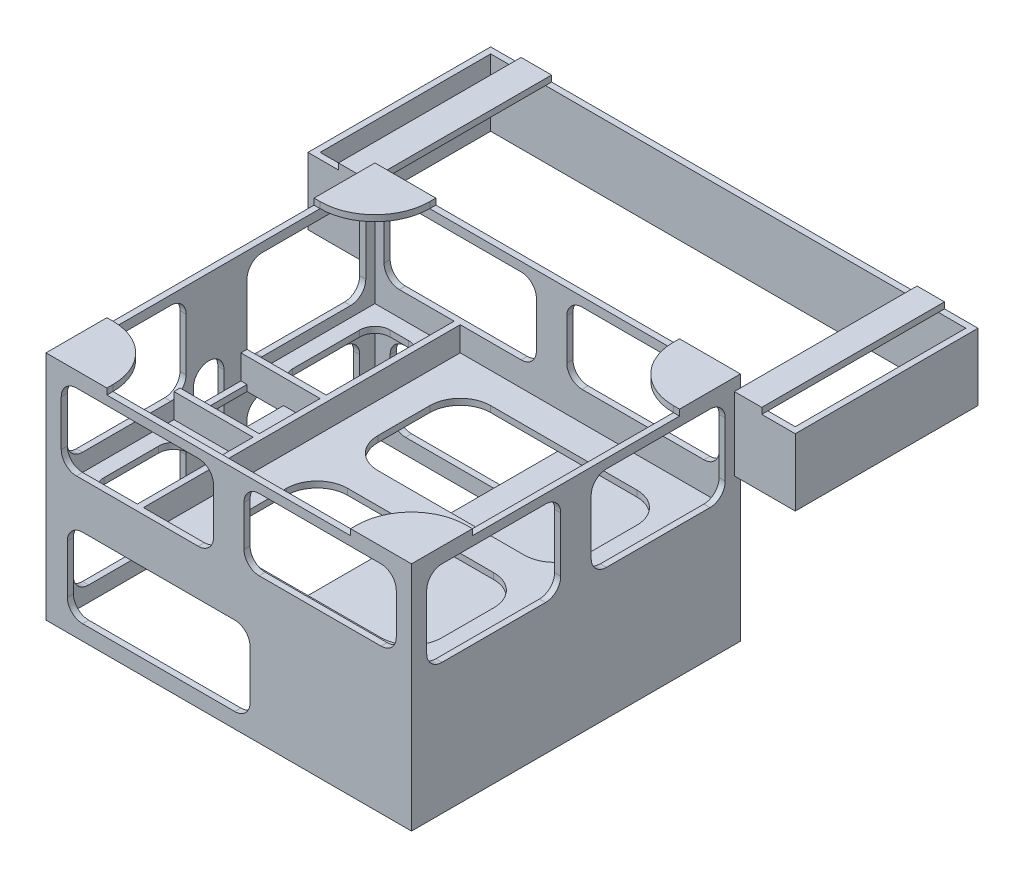
from build123d import *

# Parameters (mm, degrees)
SKETCH1_W                = 60
SKETCH1_H                = 54
BOSS_EXTRUDE1_DEPTH      = 38
SKETCH2_W                = 44
SKETCH2_H                = 52
CUT_EXTRUDE1_DEPTH       = 19
SKETCH3_W                = 35
SKETCH3_H                = 52
CUT_EXTRUDE2_DEPTH       = 18
SKETCH4_W                = 6
SKETCH4_H                = 10
CUT_EXTRUDE3_DEPTH       = 38
SKETCH5_W                = 14
SKETCH5_H                = 52
CUT_EXTRUDE5_DEPTH       = 15
SKETCH6_W                = 13
SKETCH6_H                = 52
CUT_EXTRUDE6_DEPTH       = 4
SKETCH8_W                = 15
SKETCH8_H                = 13
CUT_EXTRUDE7_DEPTH       = 6
SKETCH10_W               = 13
SKETCH10_H               = 5
CUT_EXTRUDE8_DEPTH       = 6
SKETCH11_W               = 4
SKETCH11_H               = 5
CUT_EXTRUDE9_DEPTH       = 3
SKETCH12_W               = 5
SKETCH12_H               = 2
CUT_EXTRUDE10_DEPTH      = 13
CUT_EXTRUDE11_DEPTH      = 1
SKETCH14_W               = 13
SKETCH14_H               = 1
BOSS_EXTRUDE2_DEPTH      = 4
SKETCH15_W               = 13
SKETCH15_H               = 1
BOSS_EXTRUDE3_DEPTH      = 4
CUT_EXTRUDE12_DEPTH      = 1
CUT_EXTRUDE13_DEPTH      = 1
CUT_EXTRUDE14_DEPTH      = 1
CUT_EXTRUDE15_DEPTH      = 60
CUT_EXTRUDE16_START      = -1
CUT_EXTRUDE16_DEPTH      = 1
CUT_EXTRUDE17_DEPTH      = 100
CUT_EXTRUDE17_DEPTH_BACK = 10
CUT_EXTRUDE18_DEPTH      = 10
SKETCH23_W               = 58
SKETCH23_H               = 52
BOSS_EXTRUDE4_DEPTH      = 1
SKETCH24_W               = 40
SKETCH24_H               = 10
SKETCH24_W_2             = 10
SKETCH24_H_2             = 34
CUT_EXTRUDE20_DEPTH      = 1
FILLET1_R                = 9
FILLET2_R                = 9
FILLET3_R                = 9
FILLET4_R                = 9
SKETCH27_W               = 10
SKETCH27_H               = 11
BOSS_EXTRUDE10_DEPTH     = 1
SKETCH31_W               = 1
SKETCH31_H               = 11
BOSS_EXTRUDE12_DEPTH     = 29
SKETCH33_W               = 1
SKETCH33_H               = 11
BOSS_EXTRUDE13_DEPTH     = 78
SKETCH34_W               = 5
SKETCH34_H               = 30
SKETCH34_W_2             = 4.5
BOSS_EXTRUDE14_DEPTH     = 1


with BuildPart() as part:
    # Sketch1 → Boss-Extrude1 (new body)
    with BuildSketch(Plane(origin=(0, 0, 0), x_dir=(1, 0, 0), z_dir=(0, 1, 0))):
        with Locations((-83.874465942, -33.946435202)):
            Rectangle(SKETCH1_W, SKETCH1_H)
    extrude(amount=BOSS_EXTRUDE1_DEPTH)

    # Sketch2 → Cut-Extrude1 (cut)
    with BuildSketch(Plane(origin=(0, 38, 0), x_dir=(1, 0, 0), z_dir=(0, 1, 0))):
        with Locations((-76.874465942, -33.946435202)):
            Rectangle(SKETCH2_W, SKETCH2_H)
    extrude(amount=-CUT_EXTRUDE1_DEPTH, mode=Mode.SUBTRACT)

    # Sketch3 → Cut-Extrude2 (cut)
    with BuildSketch(Plane(origin=(0, 0, 0), x_dir=(-1, 0, 0), z_dir=(0, -1, 0))):
        with Locations((95.374465942, -33.946435202)):
            Rectangle(SKETCH3_W, SKETCH3_H)
    extrude(amount=-CUT_EXTRUDE2_DEPTH, mode=Mode.SUBTRACT)

    # Sketch4 → Cut-Extrude3 (cut)
    with BuildSketch(Plane(origin=(0, 18, 0), x_dir=(-1, 0, 0), z_dir=(0, -1, 0))):
        with Locations((108.874465942, -34.946435202)):
            Rectangle(SKETCH4_W, SKETCH4_H)
    extrude(amount=-CUT_EXTRUDE3_DEPTH, mode=Mode.SUBTRACT)

    # Sketch5 → Cut-Extrude5 (cut)
    with BuildSketch(Plane(origin=(0, 38, 0), x_dir=(1, 0, 0), z_dir=(0, 1, 0))):
        with Locations((-105.874465942, -33.946435202)):
            Rectangle(SKETCH5_W, SKETCH5_H)
    extrude(amount=-CUT_EXTRUDE5_DEPTH, mode=Mode.SUBTRACT)

    # Sketch6 → Cut-Extrude6 (cut)
    with BuildSketch(Plane(origin=(0, 23, 0), x_dir=(1, 0, 0), z_dir=(0, 1, 0))):
        with Locations((-106.374465942, -33.946435202)):
            Rectangle(SKETCH6_W, SKETCH6_H)
    extrude(amount=-CUT_EXTRUDE6_DEPTH, mode=Mode.SUBTRACT)

    # Sketch8 → Cut-Extrude7 (cut)
    with BuildSketch(Plane(origin=(0, 0, 0), x_dir=(-1, 0, 0), z_dir=(0, -1, 0))):
        with Locations((65.874465942, -17.946435202)):
            Rectangle(SKETCH8_W, SKETCH8_H)
    extrude(amount=-CUT_EXTRUDE7_DEPTH, mode=Mode.SUBTRACT)

    # Sketch10 → Cut-Extrude8 (cut)
    with BuildSketch(Plane(origin=(-73.374465942, 0, 0), x_dir=(0, 0, -1), z_dir=(1, 0, 0))):
        with Locations((-17.946435202, 3.5)):
            Rectangle(SKETCH10_W, SKETCH10_H)
    extrude(amount=-CUT_EXTRUDE8_DEPTH, mode=Mode.SUBTRACT)

    # Sketch11 → Cut-Extrude9 (cut)
    with BuildSketch(Plane.XZ):
        with Locations((-65.874465942, 48.446435202)):
            Rectangle(SKETCH11_W, SKETCH11_H)
    extrude(amount=-CUT_EXTRUDE9_DEPTH, mode=Mode.SUBTRACT)

    # Sketch12 → Cut-Extrude10 (cut)
    with BuildSketch(Plane(origin=(-67.874465942, 0, 0), x_dir=(0, 0, -1), z_dir=(1, 0, 0))):
        with Locations((-48.446435202, 2)):
            Rectangle(SKETCH12_W, SKETCH12_H)
    extrude(amount=-CUT_EXTRUDE10_DEPTH, mode=Mode.SUBTRACT)

    # Sketch13 → Cut-Extrude11 (cut)
    with BuildSketch(Plane.ZY.offset(113.874465942)):
        with BuildLine():
            Line((32.733045904, 15), (32.733045904, 22))
            ThreePointArc((32.733045904, 22), (35.233045904, 24.5), (37.733045904, 22))
            Line((37.733045904, 22), (37.733045904, 15))
            ThreePointArc((37.733045904, 15), (35.233045904, 12.5), (32.733045904, 15))
        make_face()
    extrude(amount=-CUT_EXTRUDE11_DEPTH, mode=Mode.SUBTRACT)

    # Sketch14 → Boss-Extrude2 (add)
    with BuildSketch(Plane(origin=(0, 19, 0), x_dir=(1, 0, 0), z_dir=(0, 1, 0))):
        with Locations((-106.374465942, -40.446435202)):
            Rectangle(SKETCH14_W, SKETCH14_H)
    extrude(amount=BOSS_EXTRUDE2_DEPTH)

    # Sketch15 → Boss-Extrude3 (add)
    with BuildSketch(Plane(origin=(0, 19, 0), x_dir=(1, 0, 0), z_dir=(0, 1, 0))):
        with Locations((-106.374465942, -29.446435202)):
            Rectangle(SKETCH15_W, SKETCH15_H)
    extrude(amount=BOSS_EXTRUDE3_DEPTH)

    # Sketch16 → Cut-Extrude12 (cut)
    with BuildSketch(Plane(origin=(0, 19, 0), x_dir=(1, 0, 0), z_dir=(0, 1, 0))):
        with BuildLine():
            Line((-64.874465942, -54.946435202), (-88.874465942, -54.946435202))
            ThreePointArc((-88.874465942, -54.946435202), (-92.409999848, -53.481969108), (-93.874465942, -49.946435202))
            Line((-93.874465942, -49.946435202), (-93.874465942, -41.446435202))
            ThreePointArc((-93.874465942, -41.446435202), (-92.409999848, -37.910901296), (-88.874465942, -36.446435202))
            Line((-88.874465942, -36.446435202), (-64.874465942, -36.446435202))
            ThreePointArc((-64.874465942, -36.446435202), (-61.338932037, -37.910901296), (-59.874465942, -41.446435202))
            Line((-59.874465942, -41.446435202), (-59.874465942, -49.946435202))
            ThreePointArc((-59.874465942, -49.946435202), (-61.338932037, -53.481969108), (-64.874465942, -54.946435202))
        make_face()
        with BuildLine():
            Line((-88.874465942, -31.446435202), (-64.874465942, -31.446435202))
            ThreePointArc((-64.874465942, -31.446435202), (-61.338932037, -29.981969108), (-59.874465942, -26.446435202))
            Line((-59.874465942, -26.446435202), (-59.874465942, -17.946435202))
            ThreePointArc((-59.874465942, -17.946435202), (-61.338932037, -14.410901296), (-64.874465942, -12.946435202))
            Line((-64.874465942, -12.946435202), (-88.874465942, -12.946435202))
            ThreePointArc((-88.874465942, -12.946435202), (-92.409999848, -14.410901296), (-93.874465942, -17.946435202))
            Line((-93.874465942, -17.946435202), (-93.874465942, -26.446435202))
            ThreePointArc((-93.874465942, -26.446435202), (-92.409999848, -29.981969108), (-88.874465942, -31.446435202))
        make_face()
    extrude(amount=-CUT_EXTRUDE12_DEPTH, mode=Mode.SUBTRACT)

    # Sketch17 → Cut-Extrude13 (cut)
    with BuildSketch(Plane(origin=(0, 19, 0), x_dir=(1, 0, 0), z_dir=(0, 1, 0))):
        with BuildLine():
            Line((-104.874465942, -57.446435202), (-107.874465942, -57.446435202))
            ThreePointArc((-107.874465942, -57.446435202), (-109.642232895, -56.714202155), (-110.374465942, -54.946435202))
            Line((-110.374465942, -54.946435202), (-110.374465942, -45.946435202))
            ThreePointArc((-110.374465942, -45.946435202), (-109.642232895, -44.178668249), (-107.874465942, -43.446435202))
            Line((-107.874465942, -43.446435202), (-104.874465942, -43.446435202))
            ThreePointArc((-104.874465942, -43.446435202), (-103.10669899, -44.178668249), (-102.374465942, -45.946435202))
            Line((-102.374465942, -45.946435202), (-102.374465942, -54.946435202))
            ThreePointArc((-102.374465942, -54.946435202), (-103.10669899, -56.714202155), (-104.874465942, -57.446435202))
        make_face()
        with BuildLine():
            Line((-104.874465942, -26.446435202), (-107.874465942, -26.446435202))
            ThreePointArc((-107.874465942, -26.446435202), (-109.642232895, -25.714202155), (-110.374465942, -23.946435202))
            Line((-110.374465942, -23.946435202), (-110.374465942, -12.946435202))
            ThreePointArc((-110.374465942, -12.946435202), (-109.642232895, -11.178668249), (-107.874465942, -10.446435202))
            Line((-107.874465942, -10.446435202), (-104.874465942, -10.446435202))
            ThreePointArc((-104.874465942, -10.446435202), (-103.10669899, -11.178668249), (-102.374465942, -12.946435202))
            Line((-102.374465942, -12.946435202), (-102.374465942, -23.946435202))
            ThreePointArc((-102.374465942, -23.946435202), (-103.10669899, -25.714202155), (-104.874465942, -26.446435202))
        make_face()
    extrude(amount=-CUT_EXTRUDE13_DEPTH, mode=Mode.SUBTRACT)

    # Sketch18 → Cut-Extrude14 (cut)
    with BuildSketch(Plane(origin=(-53.874465942, 0, 0), x_dir=(0, 0, -1), z_dir=(1, 0, 0))):
        with BuildLine():
            Line((-55.946435202, 35.5), (-38.946435202, 35.5))
            ThreePointArc((-38.946435202, 35.5), (-37.178668249, 34.767766953), (-36.446435202, 33))
            Line((-36.446435202, 33), (-36.446435202, 24))
            ThreePointArc((-36.446435202, 24), (-37.178668249, 22.232233047), (-38.946435202, 21.5))
            Line((-38.946435202, 21.5), (-55.946435202, 21.5))
            ThreePointArc((-55.946435202, 21.5), (-57.714202155, 22.232233047), (-58.446435202, 24))
            Line((-58.446435202, 24), (-58.446435202, 33))
            ThreePointArc((-58.446435202, 33), (-57.714202155, 34.767766953), (-55.946435202, 35.5))
        make_face()
        with BuildLine():
            Line((-28.946435202, 35.5), (-11.946435202, 35.5))
            ThreePointArc((-11.946435202, 35.5), (-10.178668249, 34.767766953), (-9.446435202, 33))
            Line((-9.446435202, 33), (-9.446435202, 24))
            ThreePointArc((-9.446435202, 24), (-10.178668249, 22.232233047), (-11.946435202, 21.5))
            Line((-11.946435202, 21.5), (-28.946435202, 21.5))
            ThreePointArc((-28.946435202, 21.5), (-30.714202155, 22.232233047), (-31.446435202, 24))
            Line((-31.446435202, 24), (-31.446435202, 33))
            ThreePointArc((-31.446435202, 33), (-30.714202155, 34.767766953), (-28.946435202, 35.5))
        make_face()
    extrude(amount=-CUT_EXTRUDE14_DEPTH, mode=Mode.SUBTRACT)

    # Sketch19 → Cut-Extrude15 (cut)
    with BuildSketch(Plane(origin=(0, 0, 6.946435202), x_dir=(-1, 0, 0), z_dir=(0, 0, -1))):
        with BuildLine():
            Line((58.874465942, 35.5), (78.874465942, 35.5))
            ThreePointArc((78.874465942, 35.5), (80.642232895, 34.767766953), (81.374465942, 33))
            Line((81.374465942, 33), (81.374465942, 26.304053451))
            ThreePointArc((81.374465942, 26.304053451), (80.642232895, 24.536286498), (78.874465942, 23.804053451))
            Line((78.874465942, 23.804053451), (58.874465942, 23.804053451))
            ThreePointArc((58.874465942, 23.804053451), (57.10669899, 24.536286498), (56.374465942, 26.304053451))
            Line((56.374465942, 26.304053451), (56.374465942, 33))
            ThreePointArc((56.374465942, 33), (57.10669899, 34.767766953), (58.874465942, 35.5))
        make_face()
        with BuildLine():
            Line((88.874465942, 35.5), (108.874465942, 35.5))
            ThreePointArc((108.874465942, 35.5), (110.642232895, 34.767766953), (111.374465942, 33))
            Line((111.374465942, 33), (111.374465942, 25.5))
            ThreePointArc((111.374465942, 25.5), (110.642232895, 23.732233047), (108.874465942, 23))
            Line((108.874465942, 23), (88.874465942, 23))
            ThreePointArc((88.874465942, 23), (87.10669899, 23.732233047), (86.374465942, 25.5))
            Line((86.374465942, 25.5), (86.374465942, 33))
            ThreePointArc((86.374465942, 33), (87.10669899, 34.767766953), (88.874465942, 35.5))
        make_face()
    extrude(amount=-CUT_EXTRUDE15_DEPTH, mode=Mode.SUBTRACT)

    # Sketch20 → Cut-Extrude16 (cut)
    with BuildSketch(Plane.ZY.offset(113.874465942).offset(CUT_EXTRUDE16_START)):
        with BuildLine():
            Line((11.946435202, 35.5), (26.446435202, 35.5))
            ThreePointArc((26.446435202, 35.5), (28.214202155, 34.767766953), (28.946435202, 33))
            Line((28.946435202, 33), (28.946435202, 23.221982389))
            ThreePointArc((28.946435202, 23.221982389), (28.214202155, 21.454215436), (26.446435202, 20.721982389))
            Line((26.446435202, 20.721982389), (11.946435202, 20.721982389))
            ThreePointArc((11.946435202, 20.721982389), (10.178668249, 21.454215436), (9.446435202, 23.221982389))
            Line((9.446435202, 23.221982389), (9.446435202, 33))
            ThreePointArc((9.446435202, 33), (10.178668249, 34.767766953), (11.946435202, 35.5))
        make_face()
        with BuildLine():
            Line((41.446435202, 35.5), (55.946435202, 35.5))
            ThreePointArc((55.946435202, 35.5), (57.714202155, 34.767766953), (58.446435202, 33))
            Line((58.446435202, 33), (58.446435202, 24.375603128))
            ThreePointArc((58.446435202, 24.375603128), (57.714202155, 22.607836175), (55.946435202, 21.875603128))
            Line((55.946435202, 21.875603128), (41.446435202, 21.875603128))
            ThreePointArc((41.446435202, 21.875603128), (39.678668249, 22.607836175), (38.946435202, 24.375603128))
            Line((38.946435202, 24.375603128), (38.946435202, 33))
            ThreePointArc((38.946435202, 33), (39.678668249, 34.767766953), (41.446435202, 35.5))
        make_face()
    extrude(amount=CUT_EXTRUDE16_DEPTH, mode=Mode.SUBTRACT)

    # Sketch21 → Cut-Extrude17 (cut, two sides: drawn at the far end of the back side and taken through both)
    with BuildSketch(Plane(origin=(0, 0, 59.946435202), x_dir=(-1, 0, 0), z_dir=(0, 0, -1)).offset(-CUT_EXTRUDE17_DEPTH_BACK)):
        with BuildLine():
            Line((107.874465942, 2.5), (82.874465942, 2.5))
            ThreePointArc((82.874465942, 2.5), (81.10669899, 3.232233047), (80.374465942, 5))
            Line((80.374465942, 5), (80.374465942, 13))
            ThreePointArc((80.374465942, 13), (81.10669899, 14.767766953), (82.874465942, 15.5))
            Line((82.874465942, 15.5), (107.874465942, 15.5))
            ThreePointArc((107.874465942, 15.5), (109.642232895, 14.767766953), (110.374465942, 13))
            Line((110.374465942, 13), (110.374465942, 5))
            ThreePointArc((110.374465942, 5), (109.642232895, 3.232233047), (107.874465942, 2.5))
        make_face()
    extrude(amount=CUT_EXTRUDE17_DEPTH + CUT_EXTRUDE17_DEPTH_BACK, mode=Mode.SUBTRACT)

    # Sketch22 → Cut-Extrude18 (cut)
    with BuildSketch(Plane(origin=(-112.874465942, 0, 0), x_dir=(0, 0, -1), z_dir=(1, 0, 0))):
        with BuildLine():
            Line((-12.946435202, 2.5), (-26.446435202, 2.5))
            ThreePointArc((-26.446435202, 2.5), (-28.214202155, 3.232233047), (-28.946435202, 5))
            Line((-28.946435202, 5), (-28.946435202, 13))
            ThreePointArc((-28.946435202, 13), (-28.214202155, 14.767766953), (-26.446435202, 15.5))
            Line((-26.446435202, 15.5), (-12.946435202, 15.5))
            ThreePointArc((-12.946435202, 15.5), (-11.178668249, 14.767766953), (-10.446435202, 13))
            Line((-10.446435202, 13), (-10.446435202, 5))
            ThreePointArc((-10.446435202, 5), (-11.178668249, 3.232233047), (-12.946435202, 2.5))
        make_face()
        with BuildLine():
            Line((-41.446435202, 2.5), (-54.946435202, 2.5))
            ThreePointArc((-54.946435202, 2.5), (-56.714202155, 3.232233047), (-57.446435202, 5))
            Line((-57.446435202, 5), (-57.446435202, 13))
            ThreePointArc((-57.446435202, 13), (-56.714202155, 14.767766953), (-54.946435202, 15.5))
            Line((-54.946435202, 15.5), (-41.446435202, 15.5))
            ThreePointArc((-41.446435202, 15.5), (-39.678668249, 14.767766953), (-38.946435202, 13))
            Line((-38.946435202, 13), (-38.946435202, 5))
            ThreePointArc((-38.946435202, 5), (-39.678668249, 3.232233047), (-41.446435202, 2.5))
        make_face()
    extrude(amount=-CUT_EXTRUDE18_DEPTH, mode=Mode.SUBTRACT)

    # Sketch23 → Boss-Extrude4 (add)
    with BuildSketch(Plane(origin=(0, 38, 0), x_dir=(1, 0, 0), z_dir=(0, 1, 0))):
        with Locations((-83.874465942, -33.946435202)):
            Rectangle(SKETCH23_W, SKETCH23_H)
    extrude(amount=-BOSS_EXTRUDE4_DEPTH)

    # Sketch24 → Cut-Extrude20 (cut)
    with BuildSketch(Plane(origin=(0, 38, 0), x_dir=(1, 0, 0), z_dir=(0, 1, 0))):
        with Locations((-83.874465942, -55.946435202)):
            Rectangle(SKETCH24_W, SKETCH24_H)
        with Locations((-58.874465942, -33.946435202)):
            Rectangle(SKETCH24_W_2, SKETCH24_H_2)
        with Locations((-83.874465942, -11.946435202)):
            Rectangle(SKETCH24_W, SKETCH24_H)
        with Locations((-83.874465942, -33.946435202)):
            Rectangle(SKETCH24_W, SKETCH24_H_2)
        with Locations((-108.874465942, -33.946435202)):
            Rectangle(SKETCH24_W_2, SKETCH24_H_2)
    extrude(amount=-CUT_EXTRUDE20_DEPTH, mode=Mode.SUBTRACT)

    # Fillet1
    fillet1_edges = [part.edges().sort_by_distance(p)[0] for p in [
        (-103.874465942, 37.5, 50.946435202),
    ]]
    fillet(fillet1_edges, radius=FILLET1_R)

    # Fillet2
    fillet2_edges = [part.edges().sort_by_distance(p)[0] for p in [
        (-63.874465942, 37.5, 16.946435202),
    ]]
    fillet(fillet2_edges, radius=FILLET2_R)

    # Fillet3
    fillet3_edges = [part.edges().sort_by_distance(p)[0] for p in [
        (-63.874465942, 37.5, 50.946435202),
    ]]
    fillet(fillet3_edges, radius=FILLET3_R)

    # Fillet4
    fillet4_edges = [part.edges().sort_by_distance(p)[0] for p in [
        (-103.874465942, 37.5, 16.946435202),
    ]]
    fillet(fillet4_edges, radius=FILLET4_R)

    # Sketch27 → Boss-Extrude10 (add)
    with BuildSketch(Plane(origin=(0, 0, 6.946435202), x_dir=(-1, 0, 0), z_dir=(0, 0, -1))):
        with Locations((48.874465942, 29.5)):
            Rectangle(SKETCH27_W, SKETCH27_H)
        with Locations((118.874465942, 29.5)):
            Rectangle(SKETCH27_W, SKETCH27_H)
    extrude(amount=-BOSS_EXTRUDE10_DEPTH)

    # Sketch31 → Boss-Extrude12 (add)
    with BuildSketch(Plane(origin=(0, 0, 6.946435202), x_dir=(-1, 0, 0), z_dir=(0, 0, -1))):
        with Locations((44.374465942, 29.5)):
            Rectangle(SKETCH31_W, SKETCH31_H)
        with Locations((123.374465942, 29.5)):
            Rectangle(SKETCH31_W, SKETCH31_H)
    extrude(amount=BOSS_EXTRUDE12_DEPTH)

    # Sketch33 → Boss-Extrude13 (add)
    with BuildSketch(Plane.ZY.offset(44.874465942)):
        with Locations((-21.553564798, 29.5)):
            Rectangle(SKETCH33_W, SKETCH33_H)
    extrude(amount=BOSS_EXTRUDE13_DEPTH)

    # Sketch34 → Boss-Extrude14 (add)
    with BuildSketch(Plane(origin=(0, 35, 0), x_dir=(1, 0, 0), z_dir=(0, 1, 0))):
        with Locations((-116.374465942, 7.053564798)):
            Rectangle(SKETCH34_W, SKETCH34_H)
        with Locations((-51.624465942, 7.053564798)):
            Rectangle(SKETCH34_W_2, SKETCH34_H)
    extrude(amount=BOSS_EXTRUDE14_DEPTH)


solid = part.part
